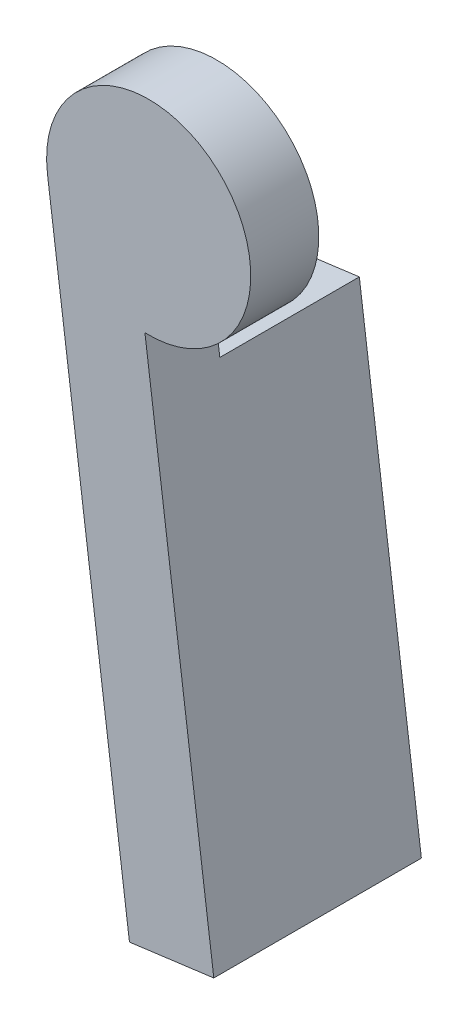
from build123d import *

# Parameters (mm, degrees)
SKETCH1_R           = 19.05
BOSS_EXTRUDE1_DEPTH = 12.7
BOSS_EXTRUDE2_START = -12.7
BOSS_EXTRUDE2_DEPTH = 12.7
BOSS_EXTRUDE3_DEPTH = 26.035


with BuildPart() as part:
    # Sketch1 → Boss-Extrude1 (new body)
    with BuildSketch(Plane.XY):
        Circle(SKETCH1_R)
    extrude(amount=BOSS_EXTRUDE1_DEPTH)

    # Sketch2 → Boss-Extrude2 (add)
    with BuildSketch(Plane.XY.offset(12.7).offset(BOSS_EXTRUDE2_START)):
        with BuildLine():
            Line((-18.887735318, -2.481119615), (-3.587497693, -118.955487411))
            Line((-3.587497693, -118.955487411), (12.152281739, -116.887887732))
            Line((12.152281739, -116.887887732), (-0.701538954, -19.037078113))
            ThreePointArc((-0.701538954, -19.037078113), (-12.824190309, -14.08696713), (-18.887735318, -2.481119615))
        make_face()
    extrude(amount=BOSS_EXTRUDE2_DEPTH)

    # Sketch3 → Boss-Extrude3 (add)
    with BuildSketch(Plane(origin=(0, 0, 0), x_dir=(-1, 0, 0), z_dir=(0, 0, -1))):
        Polygon((3.587497693, -118.955487411), (-12.152281739, -116.887887732), (-0.573723536, -28.745122913), (15.166055896, -30.812722592), align=None)
    extrude(amount=BOSS_EXTRUDE3_DEPTH)


solid = part.part
